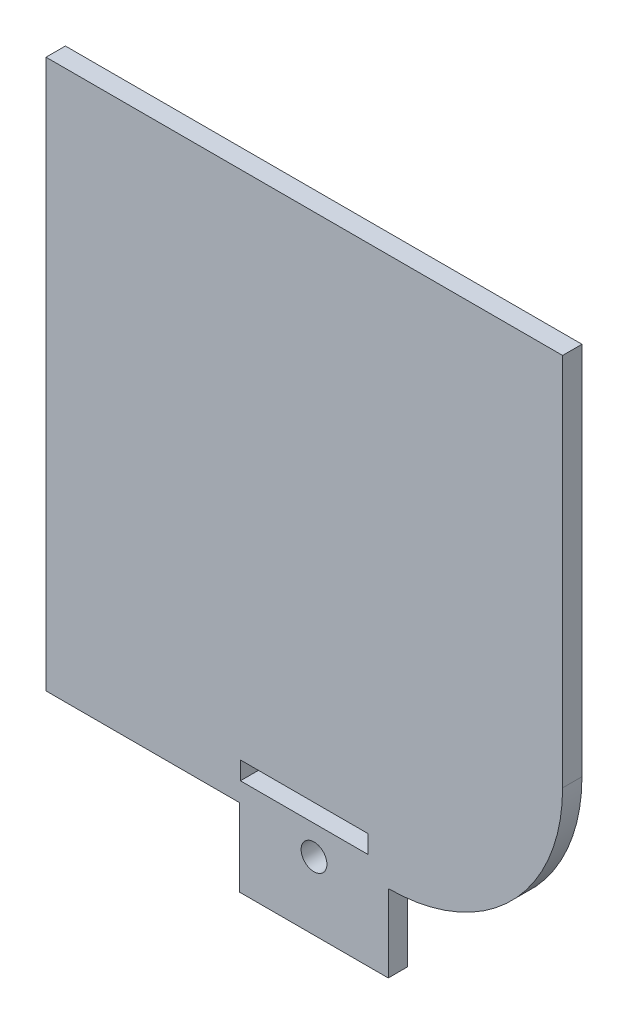
from build123d import *

# Parameters (mm, degrees)
CROQUIS1_R              = 2
CROQUIS1_W              = 19.8
CROQUIS1_H              = 2.8
SALIENTE_EXTRUIR1_DEPTH = 3


with BuildPart() as part:
    # Croquis1 → Saliente-Extruir1 (new body)
    with BuildSketch(Plane.XY):
        with BuildLine():
            Line((-40, 29), (40, 29))
            Line((40, 29), (40, -29))
            ThreePointArc((40, -29), (32.091883092, -48.091883092), (13, -56))
            Line((13, -56), (13, -68))
            Line((13, -68), (-10, -68))
            Line((-10, -68), (-10, -56))
            Line((-10, -56), (-40, -56))
            Line((-40, -56), (-40, 29))
        make_face()
        with Locations((1.5, -57.5)):
            Circle(CROQUIS1_R, mode=Mode.SUBTRACT)
        with Locations((0, -51.6)):
            Rectangle(CROQUIS1_W, CROQUIS1_H, mode=Mode.SUBTRACT)
    extrude(amount=SALIENTE_EXTRUIR1_DEPTH)


solid = part.part
